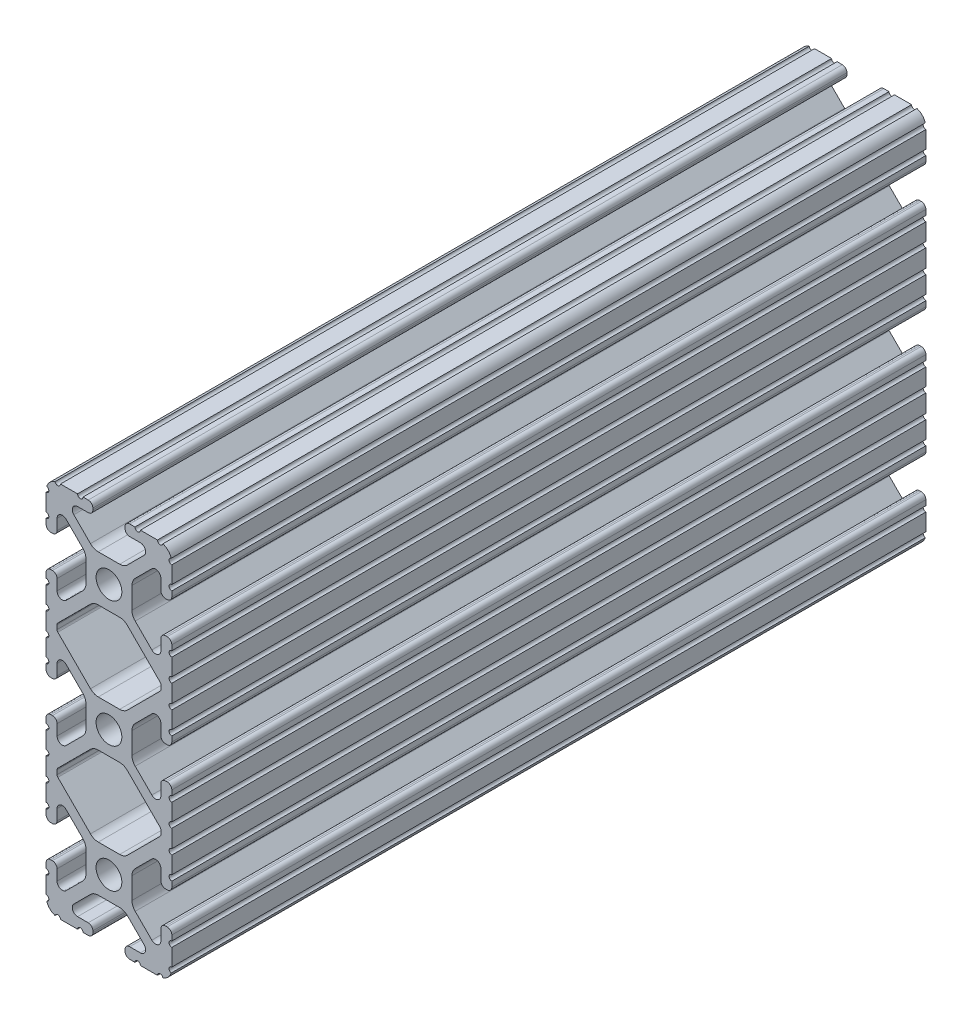
from build123d import *

# Parameters (mm, degrees)
BOSS_EXTRUDE1_DEPTH     = 76.2
CUT_EXTRUDE1_DEPTH      = 87.135590786
CUT_EXTRUDE1_DEPTH_BACK = 87.135590786
SKETCH5_R               = 0.55245
BOSS_EXTRUDE2_DEPTH     = 76.2
CUT_EXTRUDE2_DEPTH      = 87.135590786
CUT_EXTRUDE2_DEPTH_BACK = 87.135590786


with BuildPart() as part:
    # Sketch4 → Boss-Extrude1 (new, symmetric)
    with BuildSketch(Plane.XY):
        with BuildLine():
            Line((4.190365, -38.1), (10.11729625, -38.1))
            ThreePointArc((10.11729625, -38.1), (11.943543585, -37.343543585), (12.7, -35.51729625))
            Line((12.7, -35.51729625), (12.7, -29.590365))
            ThreePointArc((12.7, -29.590365), (12.42492494, -28.92627506), (11.760835, -28.6512))
            Line((11.760835, -28.6512), (11.429365, -28.6512))
            ThreePointArc((11.429365, -28.6512), (10.76527506, -28.92627506), (10.4902, -29.590365))
            Line((10.4902, -29.590365), (10.4902, -31.748478019))
            ThreePointArc((10.4902, -31.748478019), (9.830707141, -32.735478831), (8.666460301, -32.503895736))
            Line((8.666460301, -32.503895736), (5.299899128, -29.137334563))
            ThreePointArc((5.299899128, -29.137334563), (4.817571085, -28.415479634), (4.6482, -27.56399369))
            Line((4.6482, -27.56399369), (4.6482, -25.4))
            Line((4.6482, -25.4), (2.6035, -25.4))
            ThreePointArc((2.6035, -25.4), (1.840952505, -27.240952505), (0, -28.0035))
            Line((0, -28.0035), (0, -30.0482))
            Line((0, -30.0482), (2.16399369, -30.0482))
            ThreePointArc((2.16399369, -30.0482), (3.015479634, -30.217571085), (3.737334563, -30.699899128))
            Line((3.737334563, -30.699899128), (7.103895736, -34.066460301))
            ThreePointArc((7.103895736, -34.066460301), (7.335478831, -35.230707141), (6.348478019, -35.8902))
            Line((6.348478019, -35.8902), (4.190365, -35.8902))
            ThreePointArc((4.190365, -35.8902), (3.52627506, -36.16527506), (3.2512, -36.829365))
            Line((3.2512, -36.829365), (3.2512, -37.160835))
            ThreePointArc((3.2512, -37.160835), (3.52627506, -37.82492494), (4.190365, -38.1))
        make_face()
    extrude(amount=BOSS_EXTRUDE1_DEPTH, both=True)

    # Sketch5 → Cut-Extrude1 (cut, two sides: drawn at the far end of the back side and taken through both)
    with BuildSketch(Plane.XY.offset(-CUT_EXTRUDE1_DEPTH_BACK)):
        with Locations((10.356153152, -38.1)):
            Circle(SKETCH5_R)
        with Locations((5.796028019, -38.1)):
            Circle(SKETCH5_R)
        with Locations((12.7, -35.756153152)):
            Circle(SKETCH5_R)
        with Locations((12.7, -31.196028019)):
            Circle(SKETCH5_R)
    extrude(amount=CUT_EXTRUDE1_DEPTH + CUT_EXTRUDE1_DEPTH_BACK, mode=Mode.SUBTRACT)

    # Mirror1: part across plane


with BuildPart() as part_1:
    add(part.part)
    add(part.part.mirror(Plane(origin=(4.6482, -25.4, 76.2), x_dir=(0, 0, 1), z_dir=(0, -1, 0))))

    # Sketch6 → Boss-Extrude2 (add, symmetric)
    with BuildSketch(Plane.XY):
        with BuildLine():
            Line((12.7, -14.491396848), (12.7, -12.7))
            Line((12.7, -12.7), (9.803703152, -12.7))
            Line((9.803703152, -12.7), (9.803703152, -15.596296848))
            Line((9.803703152, -15.596296848), (12.7, -15.596296848))
            ThreePointArc((12.7, -15.596296848), (12.14755, -15.043846848), (12.7, -14.491396848))
        make_face()
    extrude(amount=BOSS_EXTRUDE2_DEPTH, both=True)

    # Sketch7 → Cut-Extrude2 (cut, two sides: drawn at the far end of the back side and taken through both)
    with BuildSketch(Plane.XY.offset(-CUT_EXTRUDE2_DEPTH_BACK)):
        with BuildLine():
            Line((5.420615149, -18.416820286), (10.328391141, -13.509044294))
            ThreePointArc((10.328391141, -13.509044294), (10.448147248, -13.329816615), (10.4902, -13.118403152))
            Line((10.4902, -13.118403152), (10.4902, -12.7))
            Line((10.4902, -12.7), (0, -12.7))
            Line((0, -12.7), (5.420615149, -18.416820286))
        make_face()
    extrude(amount=CUT_EXTRUDE2_DEPTH + CUT_EXTRUDE2_DEPTH_BACK, mode=Mode.SUBTRACT)

    # Mirror2: part across plane


with BuildPart() as part_2:
    add(part_1.part)
    add(part_1.part.mirror(Plane(origin=(4.190365, -12.7, 76.2), x_dir=(0, 0, 1), z_dir=(0, -1, 0))))

    # SurfaceCut1
    split(bisect_by=Plane(origin=(0, 0, 0), x_dir=(1, 0, 0), z_dir=(0, 1, 0)), keep=Keep.BOTTOM)

    # Mirror3: part across plane


with BuildPart() as part_3:
    add(part_2.part)
    add(part_2.part.mirror(Plane(origin=(0, 0, 0), x_dir=(0, 0, 1), z_dir=(1, 0, 0))))

    # Mirror4: part across plane


with BuildPart() as part_4:
    add(part_3.part)
    add(part_3.part.mirror(Plane.ZX))


solid = part_4.part
